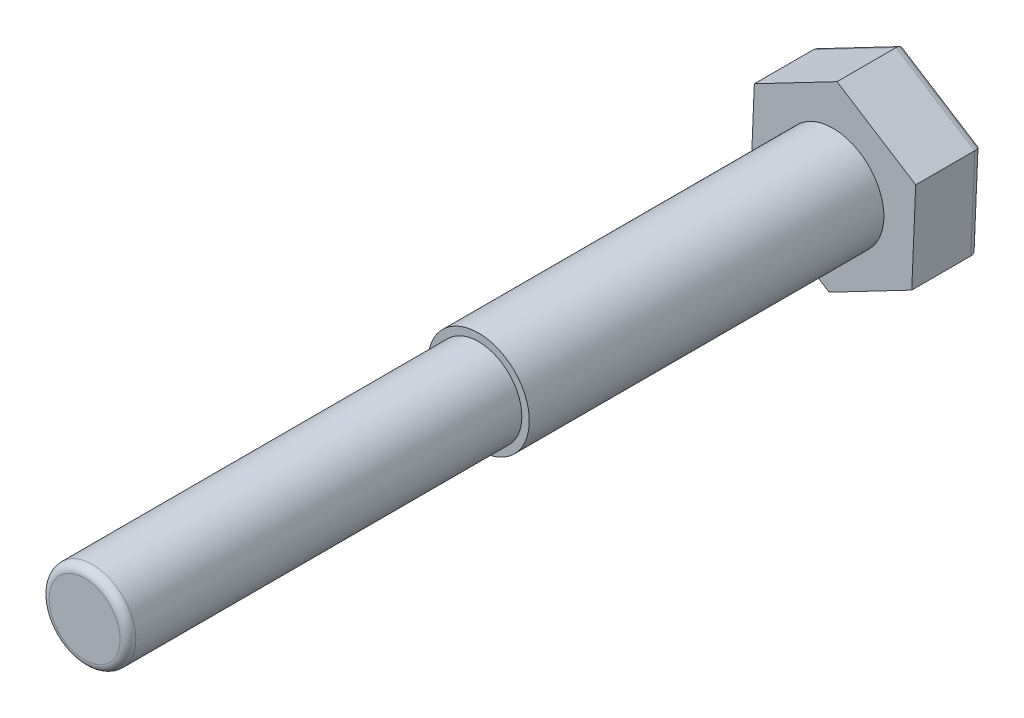
from build123d import *

# Parameters (mm, degrees)
EXTRUDE_372_DEPTH = 17
SKETCH_2_R        = 12.9
EXTRUDE_1_DEPTH   = 90
FILLET_3_R        = 2
SKETCH_3_R        = 11
EXTRUDE_2_DEPTH   = 100
FILLET_4_R        = 2


with BuildPart() as part:
    # 草图1 → Extrude 372 (new body)
    with BuildSketch(Plane.XY):
        Polygon((20.984201837, 10.954296262), (1.005402075, 23.65), (-19.978799762, 12.695703738), (-20.984201837, -10.954296262), (-1.005402075, -23.65), (19.978799762, -12.695703738), align=None)
    extrude(amount=EXTRUDE_372_DEPTH)

    # 草图2 → 凸台-拉伸1 (add)
    with BuildSketch(Plane.XY.offset(17)):
        with Locations(Location((0, 0, 0), (0, 0, 180))):
            Circle(SKETCH_2_R)
    extrude(amount=EXTRUDE_1_DEPTH)

    # 圆角3
    fillet_3_edges = [part.edges().sort_by_distance(p)[0] for p in [
        (9.486698843, -18.172851869, 0),
        (-10.994801956, -17.302148131, 0),
        (-20.4815008, 0.870703738, 0),
        (-9.486698843, 18.172851869, 0),
        (10.994801956, 17.302148131, 0),
        (20.4815008, -0.870703738, 0),
    ]]
    fillet(fillet_3_edges, radius=FILLET_3_R)

    # 草图3 → 凸台-拉伸2 (add)
    with BuildSketch(Plane.XY.offset(107)):
        Circle(SKETCH_3_R)
    extrude(amount=EXTRUDE_2_DEPTH)

    # 圆角4
    fillet_4_edges = [part.edges().sort_by_distance(p)[0] for p in [
        (-11, 0, 207),
    ]]
    fillet(fillet_4_edges, radius=FILLET_4_R)


solid = part.part
